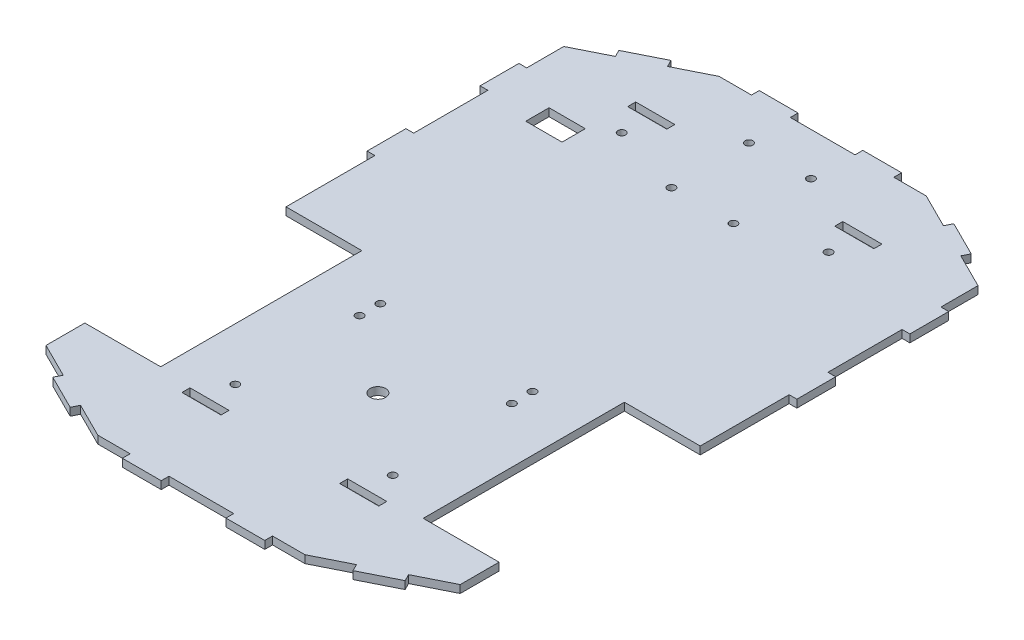
from build123d import *

# Parameters (mm, degrees)
SKETCH1_R           = 1.5
SKETCH1_R_2         = 3
SKETCH1_W           = 15.1
SKETCH1_H           = 3.1
SKETCH1_W_2         = 14
SKETCH1_H_2         = 9
BOSS_EXTRUDE1_DEPTH = 3


with BuildPart() as part:
    # Sketch1 → Boss-Extrude1 (new body)
    with BuildSketch(Plane(origin=(0, 0, 0), x_dir=(1, 0, 0), z_dir=(0, 1, 0))):
        Polygon((120, 0), (133.291796068, 6.645898034), (134.633436854, 3.962616461), (148.049844719, 10.670820393), (146.708203932, 13.354101966), (160, 20), (160, 35), (130.7, 35), (130.7, 112.71), (160, 112.71), (160, 147.0325), (163, 147.0325), (163, 162.0325), (160, 162.0325), (160, 190.6775), (163, 190.6775), (163, 205.6775), (160, 205.6775), (160, 220), (146.708203932, 226.645898034), (148.049844719, 229.329179607), (134.633436854, 236.037383539), (133.291796068, 233.354101966), (120, 240), (107.5, 240), (107.5, 243), (92.5, 243), (92.5, 240), (67.5, 240), (67.5, 243), (52.5, 243), (52.5, 240), (40, 240), (26.708203932, 233.354101966), (25.366563146, 236.037383539), (11.950155281, 229.329179607), (13.291796068, 226.645898034), (0, 220), (0, 205.6775), (-3, 205.6775), (-3, 190.6775), (0, 190.6775), (0, 162.0325), (-3, 162.0325), (-3, 147.0325), (0, 147.0325), (0, 112.71), (29.3, 112.71), (29.3, 35), (0, 35), (0, 20), (13.291796068, 13.354101966), (11.950155281, 10.670820393), (25.366563146, 3.962616461), (26.708203932, 6.645898034), (40, 0), (52.5, 0), (52.5, -3), (67.5, -3), (67.5, 0), (92.5, 0), (92.5, -3), (107.5, -3), (107.5, 0), align=None)
        with Locations(Location((50.6, 98.52, 0), (0, 0, 270))):
            Circle(SKETCH1_R, mode=Mode.SUBTRACT)
        with Locations(Location((50.6, 90.52, 0), (0, 0, 270))):
            Circle(SKETCH1_R, mode=Mode.SUBTRACT)
        with Locations(Location((68.025, 223.5, 0), (0, 0, 270))):
            Circle(SKETCH1_R, mode=Mode.SUBTRACT)
        with Locations(Location((68.025, 193.55, 0), (0, 0, 270))):
            Circle(SKETCH1_R, mode=Mode.SUBTRACT)
        with Locations(Location((91.975, 193.55, 0), (0, 0, 90))):
            Circle(SKETCH1_R, mode=Mode.SUBTRACT)
        with Locations(Location((91.975, 223.5, 0), (0, 0, 90))):
            Circle(SKETCH1_R, mode=Mode.SUBTRACT)
        with Locations(Location((109.4, 90.52, 0), (0, 0, 90))):
            Circle(SKETCH1_R, mode=Mode.SUBTRACT)
        with Locations(Location((109.4, 98.52, 0), (0, 0, 90))):
            Circle(SKETCH1_R, mode=Mode.SUBTRACT)
        with Locations(Location((40.05, 202.335880608, 0), (0, 0, 270))):
            Circle(SKETCH1_R, mode=Mode.SUBTRACT)
        with Locations(Location((49.592731594, 43.515235673, 0), (0, 0, 270))):
            Circle(SKETCH1_R, mode=Mode.SUBTRACT)
        with Locations(Location((110.407268406, 43.515235673, 0), (0, 0, 90))):
            Circle(SKETCH1_R, mode=Mode.SUBTRACT)
        with Locations(Location((119.95, 202.335880608, 0), (0, 0, 90))):
            Circle(SKETCH1_R, mode=Mode.SUBTRACT)
        with Locations(Location((80, 68.197866296, 0), (0, 0, 270))):
            Circle(SKETCH1_R_2, mode=Mode.SUBTRACT)
        with Locations((40, 213.785880608)):
            Rectangle(SKETCH1_W, SKETCH1_H, mode=Mode.SUBTRACT)
        with Locations((49.542731594, 32.073098627)):
            Rectangle(SKETCH1_W, SKETCH1_H, mode=Mode.SUBTRACT)
        with Locations((120, 213.785880608)):
            Rectangle(SKETCH1_W, SKETCH1_H, mode=Mode.SUBTRACT)
        with Locations((110.457268406, 32.073098627)):
            Rectangle(SKETCH1_W, SKETCH1_H, mode=Mode.SUBTRACT)
        with Locations((24.658359214, 192.159143415)):
            Rectangle(SKETCH1_W_2, SKETCH1_H_2, mode=Mode.SUBTRACT)
    extrude(amount=BOSS_EXTRUDE1_DEPTH)


solid = part.part
